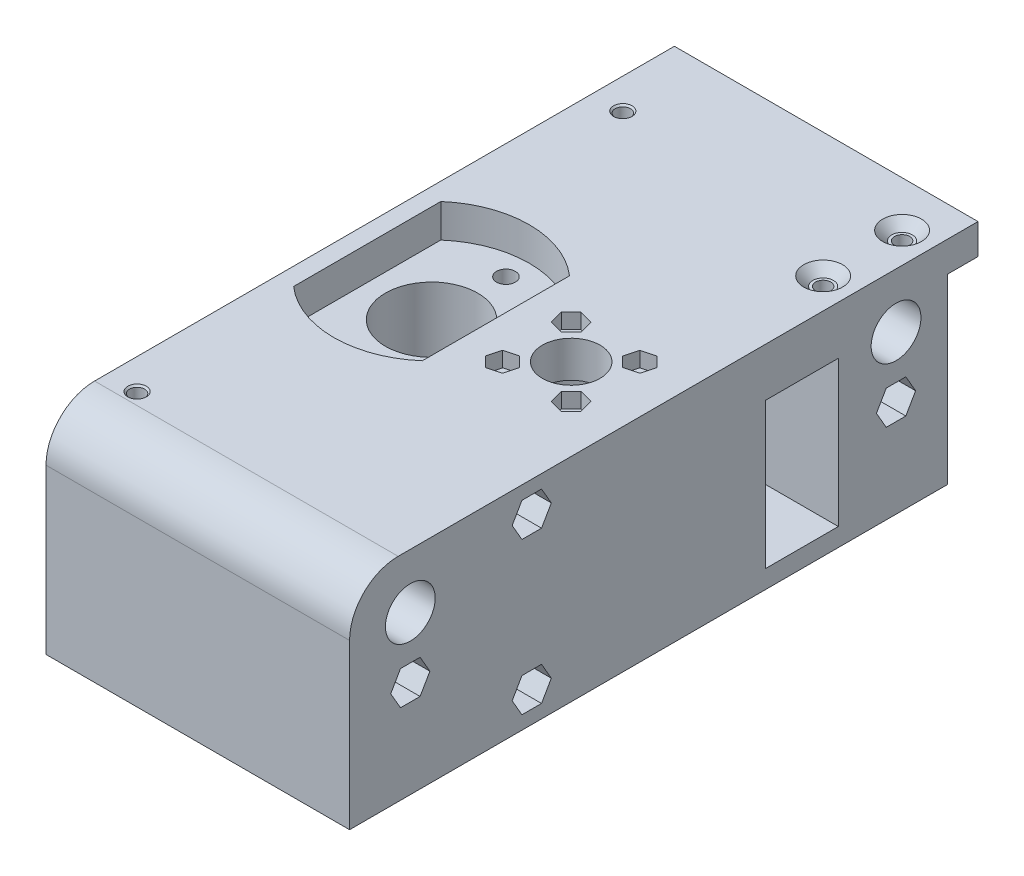
from build123d import *

# Parameters (mm, degrees)
BOSS_EXTRUDE2_DEPTH           = 50
SKETCH2_R                     = 4.1
CUT_EXTRUDE1_DEPTH            = 50
SKETCH3_W                     = 12
SKETCH3_H                     = 24
CUT_EXTRUDE2_DEPTH            = 50
SKETCH4_R                     = 1.6
CUT_EXTRUDE3_DEPTH            = 50
CUT_EXTRUDE4_DEPTH            = 35
SKETCH6_R                     = 7.6
CUT_EXTRUDE5_DEPTH            = 35
CUT_EXTRUDE6_DEPTH            = 5.5
SKETCH8_R                     = 1.55
CUT_EXTRUDE7_DEPTH            = 116.876011322
CUT_EXTRUDE8_DEPTH            = 10
SKETCH10_R                    = 11
CUT_EXTRUDE9_DEPTH            = 29
SKETCH11_R                    = 1.05
SKETCH11_R_2                  = 4.75
CUT_EXTRUDE10_DEPTH           = 116.876011322
CUT_EXTRUDE11_DEPTH           = 2.5
FILLET1_R                     = 8
M3_TAPPED_HOLE3_D             = 2.5
M3_TAPPED_HOLE3_DEPTH         = 8.5
M3_TAPPED_HOLE3_CSINK_D       = 3.05
M3_TAPPED_HOLE3_CSINK_ANGLE   = 90
M3_TAPPED_HOLE3_TIP           = 0.751075774
M3_TAPPED_HOLE4_D             = 2.5
M3_TAPPED_HOLE4_DEPTH         = 7
M3_TAPPED_HOLE4_CSINK_D       = 3.05
M3_TAPPED_HOLE4_CSINK_ANGLE   = 90
M3_TAPPED_HOLE4_TIP           = 0.751075774
SKETCH15_R                    = 3.2
CUT_EXTRUDE12_DEPTH           = 1.5
CUT_EXTRUDE12_DRAFT           = -45
CUT_EXTRUDE12_PROFILE_2_DEPTH = 1.5
CUT_EXTRUDE12_PROFILE_2_DRAFT = -45
M3_TAPPED_HOLE5_D             = 2.5
M3_TAPPED_HOLE5_DEPTH         = 7
M3_TAPPED_HOLE5_CSINK_D       = 3.05
M3_TAPPED_HOLE5_CSINK_ANGLE   = 90
M3_TAPPED_HOLE5_TIP           = 0.751075774
SKETCH17_R                    = 3.2
CUT_EXTRUDE13_DEPTH           = 1.5
CUT_EXTRUDE13_DRAFT           = -45
CUT_EXTRUDE13_PROFILE_2_DEPTH = 1.5
CUT_EXTRUDE13_PROFILE_2_DRAFT = -45


with BuildPart() as part:
    # Sketch1 → Boss-Extrude2 (new body)
    with BuildSketch(Plane(origin=(0, 0, 0), x_dir=(0, 0, -1), z_dir=(1, 0, 0))):
        Polygon((0, 30), (0, 0), (-98.5, 0), (-98.5, 35), (5, 35), (5, 30), align=None)
    extrude(amount=BOSS_EXTRUDE2_DEPTH)

    # Sketch2 → Cut-Extrude1 (cut)
    with BuildSketch(Plane(origin=(50, 0, 0), x_dir=(0, 0, -1), z_dir=(1, 0, 0))):
        with Locations((-88.5, 26)):
            Circle(SKETCH2_R)
        with Locations((-8.5, 26)):
            Circle(SKETCH2_R)
    extrude(amount=-CUT_EXTRUDE1_DEPTH, mode=Mode.SUBTRACT)

    # Sketch3 → Cut-Extrude2 (cut)
    with BuildSketch(Plane(origin=(50, 0, 0), x_dir=(0, 0, -1), z_dir=(1, 0, 0))):
        with Locations((-24, 15)):
            Rectangle(SKETCH3_W, SKETCH3_H)
    extrude(amount=-CUT_EXTRUDE2_DEPTH, mode=Mode.SUBTRACT)

    # Sketch4 → Cut-Extrude3 (cut)
    with BuildSketch(Plane(origin=(50, 0, 0), x_dir=(0, 0, -1), z_dir=(1, 0, 0))):
        with Locations((-88.5, 16)):
            Circle(SKETCH4_R)
        with Locations((-68.5, 30)):
            Circle(SKETCH4_R)
        with Locations((-68.5, 5)):
            Circle(SKETCH4_R)
        with Locations((-8.5, 16)):
            Circle(SKETCH4_R)
    extrude(amount=-CUT_EXTRUDE3_DEPTH, mode=Mode.SUBTRACT)

    # Sketch5 → Cut-Extrude4 (cut)
    with BuildSketch(Plane(origin=(50, 0, 0), x_dir=(0, 0, -1), z_dir=(1, 0, 0))):
        Polygon((-65.275, 30), (-66.8875, 32.792931927), (-70.1125, 32.792931927), (-71.725, 30), (-70.1125, 27.207068073), (-66.8875, 27.207068073), align=None)
        Polygon((-85.275, 16), (-86.8875, 18.792931927), (-90.1125, 18.792931927), (-91.725, 16), (-90.1125, 13.207068073), (-86.8875, 13.207068073), align=None)
        Polygon((-65.275, 5), (-66.8875, 7.792931927), (-70.1125, 7.792931927), (-71.725, 5), (-70.1125, 2.207068073), (-66.8875, 2.207068073), align=None)
        Polygon((-5.275, 16), (-6.8875, 18.792931927), (-10.1125, 18.792931927), (-11.725, 16), (-10.1125, 13.207068073), (-6.8875, 13.207068073), align=None)
    extrude(amount=-CUT_EXTRUDE4_DEPTH, mode=Mode.SUBTRACT)

    # Sketch6 → Cut-Extrude5 (cut)
    with BuildSketch(Plane(origin=(0, 35, 0), x_dir=(1, 0, 0), z_dir=(0, 1, 0))):
        with Locations(Location((13.5, -48.5, 0), (0, 0, 270))):
            Circle(SKETCH6_R)
    extrude(amount=-CUT_EXTRUDE5_DEPTH, mode=Mode.SUBTRACT)

    # Sketch7 → Cut-Extrude6 (cut)
    with BuildSketch(Plane(origin=(0, 35, 0), x_dir=(1, 0, 0), z_dir=(0, 1, 0))):
        with BuildLine():
            Line((24.1, -36.381831822), (24.1, -60.618168178))
            ThreePointArc((24.1, -60.618168178), (13.5, -64.6), (2.9, -60.618168178))
            Line((2.9, -60.618168178), (2.9, -36.381831822))
            ThreePointArc((2.9, -36.381831822), (13.5, -32.4), (24.1, -36.381831822))
        make_face()
    extrude(amount=-CUT_EXTRUDE6_DEPTH, mode=Mode.SUBTRACT)

    # Sketch8 → Cut-Extrude7 (cut, through all)
    with BuildSketch(Plane(origin=(0, 35, 0), x_dir=(1, 0, 0), z_dir=(0, 1, 0))):
        with Locations(Location((13.5, -36.25, 0), (0, 0, 270))):
            Circle(SKETCH8_R)
        with Locations(Location((13.5, -60.75, 0), (0, 0, 270))):
            Circle(SKETCH8_R)
    extrude(amount=-CUT_EXTRUDE7_DEPTH, mode=Mode.SUBTRACT)

    # Sketch9 → Cut-Extrude8 (cut)
    with BuildSketch(Plane.XZ):
        Polygon((16.725, 60.75), (15.1125, 63.542931927), (11.8875, 63.542931927), (10.275, 60.75), (11.8875, 57.957068073), (15.1125, 57.957068073), align=None)
        Polygon((16.725, 36.25), (15.1125, 39.042931927), (11.8875, 39.042931927), (10.275, 36.25), (11.8875, 33.457068073), (15.1125, 33.457068073), align=None)
    extrude(amount=-CUT_EXTRUDE8_DEPTH, mode=Mode.SUBTRACT)

    # Sketch10 → Cut-Extrude9 (cut)
    with BuildSketch(Plane.XZ):
        with Locations(Location((36.5, 48.5, 0), (0, 0, 270))):
            Circle(SKETCH10_R)
    extrude(amount=-CUT_EXTRUDE9_DEPTH, mode=Mode.SUBTRACT)

    # Sketch11 → Cut-Extrude10 (cut, through all)
    with BuildSketch(Plane.XZ):
        with Locations(Location((30.843145751, 54.156854249, 0), (0, 0, 270))):
            Circle(SKETCH11_R)
        with Locations(Location((42.156854249, 54.156854249, 0), (0, 0, 270))):
            Circle(SKETCH11_R)
        with Locations(Location((30.843145751, 42.843145751, 0), (0, 0, 270))):
            Circle(SKETCH11_R)
        with Locations(Location((42.156854249, 42.843145751, 0), (0, 0, 270))):
            Circle(SKETCH11_R)
        with Locations(Location((36.5, 48.5, 0), (0, 0, 270))):
            Circle(SKETCH11_R_2)
    extrude(amount=-CUT_EXTRUDE10_DEPTH, mode=Mode.SUBTRACT)

    # Sketch12 → Cut-Extrude11 (cut)
    with BuildSketch(Plane(origin=(0, 35, 0), x_dir=(1, 0, 0), z_dir=(0, 1, 0))):
        Polygon((44.388142908, -42.245273756), (42.754726244, -40.611857092), (40.523437585, -41.209729086), (39.925565591, -43.441017745), (41.558982255, -45.074434409), (43.790270914, -44.476562415), align=None)
        Polygon((44.388142908, -54.754726244), (43.790270914, -52.523437585), (41.558982255, -51.925565591), (39.925565591, -53.558982255), (40.523437585, -55.790270914), (42.754726244, -56.388142908), align=None)
        Polygon((33.074434409, -43.441017745), (32.476562415, -41.209729086), (30.245273756, -40.611857092), (28.611857092, -42.245273756), (29.209729086, -44.476562415), (31.441017745, -45.074434409), align=None)
        Polygon((33.074434409, -53.558982255), (31.441017745, -51.925565591), (29.209729086, -52.523437585), (28.611857092, -54.754726244), (30.245273756, -56.388142908), (32.476562415, -55.790270914), align=None)
    extrude(amount=-CUT_EXTRUDE11_DEPTH, mode=Mode.SUBTRACT)

    # Fillet1
    fillet1_edges = [part.edges().sort_by_distance(p)[0] for p in [
        (25, 35, 98.5),
    ]]
    fillet(fillet1_edges, radius=FILLET1_R)

    # M3 Tapped Hole3
    with Locations(Plane(origin=(5, 35, 8.5), x_dir=(0, 0, 1), z_dir=(0, 1, 0))):
        with Locations((0, 0), (80, 0)):
            CounterSinkHole(M3_TAPPED_HOLE3_D / 2, M3_TAPPED_HOLE3_CSINK_D / 2, depth=M3_TAPPED_HOLE3_DEPTH, counter_sink_angle=M3_TAPPED_HOLE3_CSINK_ANGLE)
            with Locations((0, 0, -(M3_TAPPED_HOLE3_DEPTH + M3_TAPPED_HOLE3_TIP / 2))):  # 118° drill point
                Cone(0, M3_TAPPED_HOLE3_D / 2, M3_TAPPED_HOLE3_TIP, mode=Mode.SUBTRACT)

    # M3 Tapped Hole4
    with Locations(Plane(origin=(45, 35, 2.5), x_dir=(0, 0, 1), z_dir=(0, 1, 0))):
        with Locations((0, 0), (13, 0)):
            CounterSinkHole(M3_TAPPED_HOLE4_D / 2, M3_TAPPED_HOLE4_CSINK_D / 2, depth=M3_TAPPED_HOLE4_DEPTH, counter_sink_angle=M3_TAPPED_HOLE4_CSINK_ANGLE)
            with Locations((0, 0, -(M3_TAPPED_HOLE4_DEPTH + M3_TAPPED_HOLE4_TIP / 2))):  # 118° drill point
                Cone(0, M3_TAPPED_HOLE4_D / 2, M3_TAPPED_HOLE4_TIP, mode=Mode.SUBTRACT)


with BuildPart() as cut_extrude12_tool:
    # Sketch15 → Cut-Extrude12 (with draft: the straight prism first)
    with BuildSketch(Plane(origin=(0, 35, 0), x_dir=(1, 0, 0), z_dir=(0, 1, 0))):
        with Locations((45, -2.5)):
            Circle(SKETCH15_R)
    extrude(amount=-CUT_EXTRUDE12_DEPTH)
    # Cut-Extrude12: the draft: its side faces are tilted about the plane it starts from
    cut_extrude12_sides = [cut_extrude12_tool.faces().sort_by_distance(p)[0] for p in [
        (41.8, 34.25, 2.5),
    ]]
    draft(cut_extrude12_sides, Plane(origin=(0, 35, 0), x_dir=(1, 0, 0), z_dir=(0, 1, 0)), CUT_EXTRUDE12_DRAFT)


with BuildPart() as part_1:
    add(part.part)

    # Cut-Extrude12: cut by cut_extrude12_tool
    add(cut_extrude12_tool.part, mode=Mode.SUBTRACT)


with BuildPart() as cut_extrude12_profile_2_tool:
    # Sketch15 → Cut-Extrude12 profile 2 (with draft: the straight prism first)
    with BuildSketch(Plane(origin=(0, 35, 0), x_dir=(1, 0, 0), z_dir=(0, 1, 0))):
        with Locations((45, -15.5)):
            Circle(SKETCH15_R)
    extrude(amount=-CUT_EXTRUDE12_PROFILE_2_DEPTH)
    # Cut-Extrude12 profile 2: the draft: its side faces are tilted about the plane it starts from
    cut_extrude12_profile_2_sides = [cut_extrude12_profile_2_tool.faces().sort_by_distance(p)[0] for p in [
        (41.8, 34.25, 15.5),
    ]]
    draft(cut_extrude12_profile_2_sides, Plane(origin=(0, 35, 0), x_dir=(1, 0, 0), z_dir=(0, 1, 0)), CUT_EXTRUDE12_PROFILE_2_DRAFT)


with BuildPart() as part_2:
    add(part_1.part)

    # Cut-Extrude12 profile 2: cut by cut_extrude12_profile_2_tool
    add(cut_extrude12_profile_2_tool.part, mode=Mode.SUBTRACT)

    # M3 Tapped Hole5
    with Locations(Plane(origin=(5, 0, 88.5), x_dir=(0, 0, -1), z_dir=(0, -1, 0))):
        with Locations((0, 0), (13, 0)):
            CounterSinkHole(M3_TAPPED_HOLE5_D / 2, M3_TAPPED_HOLE5_CSINK_D / 2, depth=M3_TAPPED_HOLE5_DEPTH, counter_sink_angle=M3_TAPPED_HOLE5_CSINK_ANGLE)
            with Locations((0, 0, -(M3_TAPPED_HOLE5_DEPTH + M3_TAPPED_HOLE5_TIP / 2))):  # 118° drill point
                Cone(0, M3_TAPPED_HOLE5_D / 2, M3_TAPPED_HOLE5_TIP, mode=Mode.SUBTRACT)


with BuildPart() as cut_extrude13_tool:
    # Sketch17 → Cut-Extrude13 (with draft: the straight prism first)
    with BuildSketch(Plane.XZ):
        with Locations((5, 88.5)):
            Circle(SKETCH17_R)
    extrude(amount=-CUT_EXTRUDE13_DEPTH)
    # Cut-Extrude13: the draft: its side faces are tilted about the plane it starts from
    cut_extrude13_sides = [cut_extrude13_tool.faces().sort_by_distance(p)[0] for p in [
        (1.8, 0.75, 88.5),
    ]]
    draft(cut_extrude13_sides, Plane.XZ, CUT_EXTRUDE13_DRAFT)


with BuildPart() as part_3:
    add(part_2.part)

    # Cut-Extrude13: cut by cut_extrude13_tool
    add(cut_extrude13_tool.part, mode=Mode.SUBTRACT)


with BuildPart() as cut_extrude13_profile_2_tool:
    # Sketch17 → Cut-Extrude13 profile 2 (with draft: the straight prism first)
    with BuildSketch(Plane.XZ):
        with Locations((5, 75.5)):
            Circle(SKETCH17_R)
    extrude(amount=-CUT_EXTRUDE13_PROFILE_2_DEPTH)
    # Cut-Extrude13 profile 2: the draft: its side faces are tilted about the plane it starts from
    cut_extrude13_profile_2_sides = [cut_extrude13_profile_2_tool.faces().sort_by_distance(p)[0] for p in [
        (1.8, 0.75, 75.5),
    ]]
    draft(cut_extrude13_profile_2_sides, Plane.XZ, CUT_EXTRUDE13_PROFILE_2_DRAFT)


with BuildPart() as part_4:
    add(part_3.part)

    # Cut-Extrude13 profile 2: cut by cut_extrude13_profile_2_tool
    add(cut_extrude13_profile_2_tool.part, mode=Mode.SUBTRACT)


solid = part_4.part
